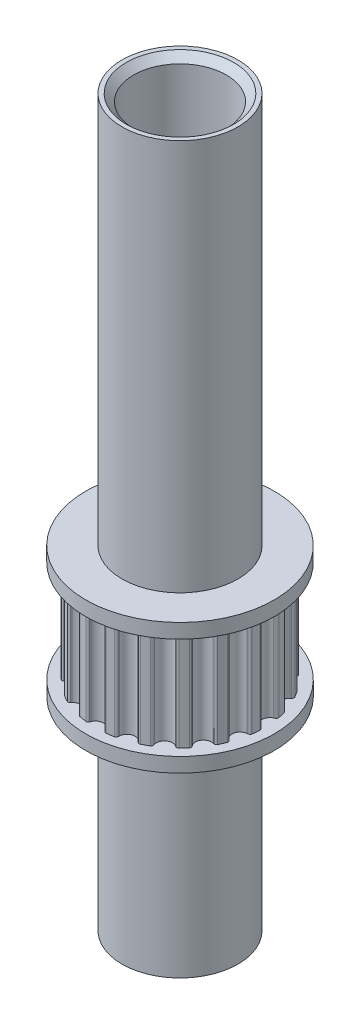
from build123d import *

# Parameters (mm, degrees)
SKETCH1_R           = 4
SKETCH1_R_2         = 3.2
BOSS_EXTRUDE1_DEPTH = 50
SKETCH2_R           = 6
SKETCH2_R_2         = 4
BOSS_EXTRUDE2_DEPTH = 7
SKETCH3_R           = 6.5
SKETCH3_R_2         = 4
BOSS_EXTRUDE3_DEPTH = 1
CUT_EXTRUDE1_DEPTH  = 7
CIRPATTERN1_COUNT   = 19
SKETCH4_R           = 6.5
SKETCH4_R_2         = 4
BOSS_EXTRUDE4_DEPTH = 1
CHAMFER1_SIZE       = 0.5


with BuildPart() as part:
    # Sketch1 → Boss-Extrude1 (new body)
    with BuildSketch(Plane(origin=(0, 0, 0), x_dir=(1, 0, 0), z_dir=(0, 1, 0))):
        Circle(SKETCH1_R)
        Circle(SKETCH1_R_2, mode=Mode.SUBTRACT)
    extrude(amount=BOSS_EXTRUDE1_DEPTH)

    # Sketch2 → Boss-Extrude2 (add)
    with BuildSketch(Plane(origin=(0, 15, 0), x_dir=(1, 0, 0), z_dir=(0, 1, 0))):
        Circle(SKETCH2_R)
        Circle(SKETCH2_R_2, mode=Mode.SUBTRACT)
    extrude(amount=BOSS_EXTRUDE2_DEPTH)

    # Sketch6 → Cut-Extrude1 (cut)
    with BuildSketch(Plane(origin=(0, 15, 0), x_dir=(1, 0, 0), z_dir=(0, 1, 0))):
        with BuildLine():
            Line((0, 6.615527095), (0, 5.795))
            ThreePointArc((0, 5.795), (0.149150627, 5.793080277), (0.298202436, 5.787322378))
            ThreePointArc((0.298202436, 5.787322378), (0.391677024, 5.748245546), (0.438987206, 5.658656239))
            ThreePointArc((0.438987206, 5.658656239), (0.444862649, 5.622209456), (0.452079377, 5.586004378))
            ThreePointArc((0.452079377, 5.586004378), (0.898978771, 5.157769008), (1.464404105, 5.409560175))
            ThreePointArc((1.464404105, 5.409560175), (1.483443985, 5.44118883), (1.501303443, 5.473498714))
            ThreePointArc((1.501303443, 5.473498714), (1.576133246, 5.541799504), (1.677316186, 5.546948297))
            ThreePointArc((1.677316186, 5.546948297), (1.819526857, 5.501940296), (1.960532009, 5.453287013))
            Line((1.960532009, 5.453287013), (2.23812815, 6.225430197))
            ThreePointArc((2.23812815, 6.225430197), (1.13593499, 6.517273237), (0, 6.615527095))
        make_face()
    cut_extrude1 = extrude(amount=CUT_EXTRUDE1_DEPTH, mode=Mode.SUBTRACT)

    # CirPattern1: Cut-Extrude1 ×19 about axis
    cirpattern1_axis = Axis((0, 50, 0), (0, -1, 0))
    for i in range(1, CIRPATTERN1_COUNT):
        add(cut_extrude1.rotate(cirpattern1_axis, i * 360 / CIRPATTERN1_COUNT), mode=Mode.SUBTRACT)

    # Sketch4 → Boss-Extrude4 (add)
    with BuildSketch(Plane(origin=(0, 22, 0), x_dir=(1, 0, 0), z_dir=(0, 1, 0))):
        Circle(SKETCH4_R)
        Circle(SKETCH4_R_2, mode=Mode.SUBTRACT)
    extrude(amount=BOSS_EXTRUDE4_DEPTH)

    # Chamfer1
    chamfer1_edges = [part.edges().sort_by_distance(p)[0] for p in [
        (-3.2, 50, 0),
        (-3.2, 0, 0),
    ]]
    chamfer(chamfer1_edges, length=CHAMFER1_SIZE)


with BuildPart() as body_2:
    # Sketch3 → Boss-Extrude3 (new body)
    with BuildSketch(Plane.XZ.offset(-15)):
        Circle(SKETCH3_R)
        Circle(SKETCH3_R_2, mode=Mode.SUBTRACT)
    extrude(amount=BOSS_EXTRUDE3_DEPTH)


solid = Compound([part.part, body_2.part])
